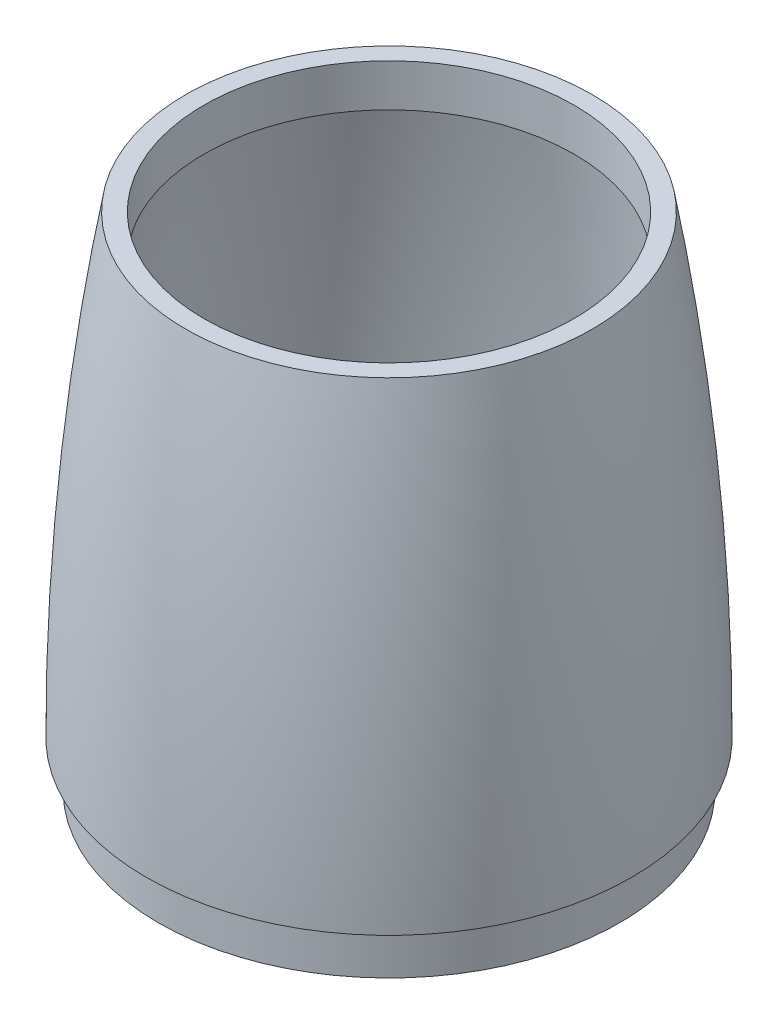
from build123d import *


with BuildPart() as part:
    # Sketch1 → Revolve1 (revolve)
    with BuildSketch(Plane.XY, mode=Mode.PRIVATE) as revolve1_sk:
        with BuildLine():
            Line((37, 0), (37, -7.5))
            Line((37, -7.5), (38, -7.5))
            Line((38, -7.5), (38, 0))
            Line((38, 0), (40, 0))
            ThreePointArc((40, 0), (38.371960017, 37.640569868), (33.5, 75))
            Line((33.5, 75), (30.5, 75))
            Line((30.5, 75), (30.5, 68))
            Line((30.5, 68), (31.626449106, 68))
            ThreePointArc((31.626449106, 68), (35.654521568, 34.105993056), (37, 0))
        make_face()
    revolve(revolve1_sk.sketch.rotate(Axis((0, 0, 0), (0, 1, 0)), 90), axis=Axis((0, 0, 0), (0, 1, 0)))


solid = part.part
